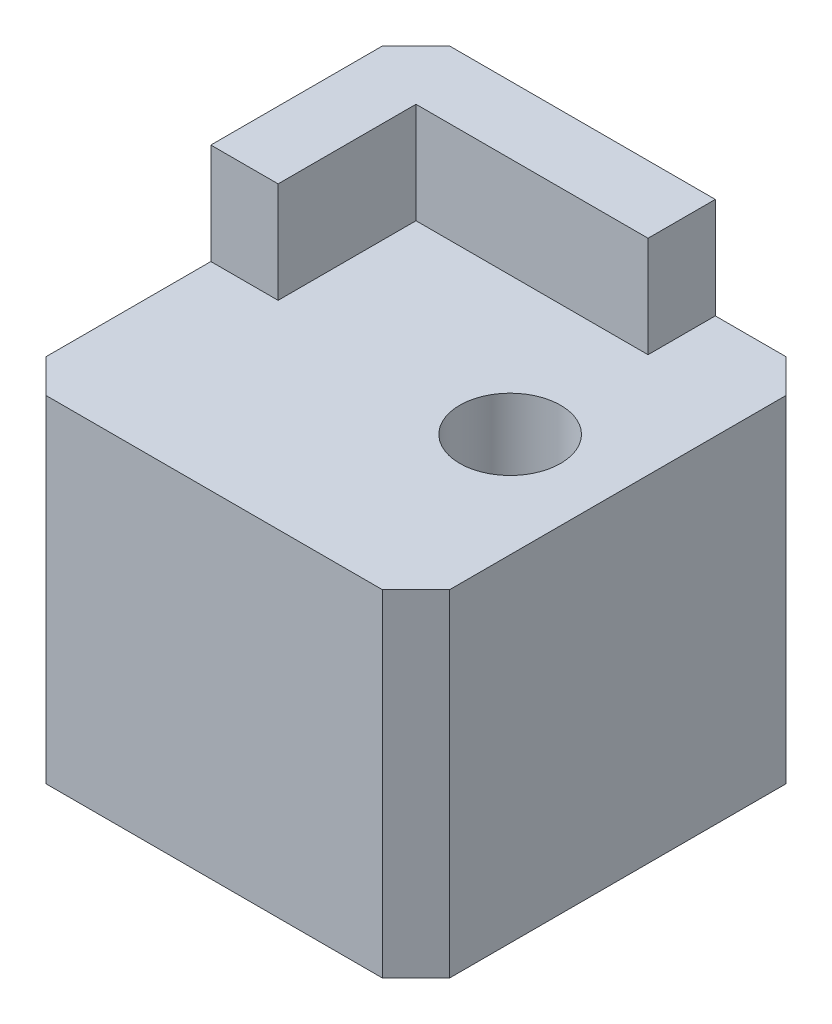
from build123d import *

# Parameters (mm, degrees)
SKETCH1_W           = 12
SKETCH1_H           = 12
BOSS_EXTRUDE1_DEPTH = 10
BOSS_EXTRUDE2_DEPTH = 3
CHAMFER1_SIZE       = 1
SKETCH1_4_R         = 1.5
CUT_EXTRUDE1_DEPTH  = 15.711220208


with BuildPart() as part:
    # Sketch1 → Boss-Extrude1 (new body)
    with BuildSketch(Plane(origin=(0, 0, 0), x_dir=(1, 0, 0), z_dir=(0, 1, 0))):
        with Locations((-2.9, 0.1)):
            Rectangle(SKETCH1_W, SKETCH1_H)
    extrude(amount=-BOSS_EXTRUDE1_DEPTH)

    # Sketch1<3> → Boss-Extrude2 (add)
    with BuildSketch(Plane(origin=(0, 0, 0), x_dir=(1, 0, 0), z_dir=(0, 1, 0))):
        Polygon((0, 6.1), (0, 4.1), (-6.9, 4.1), (-6.9, 0), (-8.9, 0), (-8.9, 6.1), align=None)
    extrude(amount=BOSS_EXTRUDE2_DEPTH)

    # Chamfer1
    chamfer1_edges = [part.edges().sort_by_distance(p)[0] for p in [
        (-8.9, -3.5, -6.1),
        (3.1, -5, -6.1),
        (3.1, -5, 5.9),
        (-8.9, -5, 5.9),
    ]]
    chamfer(chamfer1_edges, length=CHAMFER1_SIZE)

    # Sketch1<4> → Cut-Extrude1 (cut, through all)
    with BuildSketch(Plane(origin=(0, 0, 0), x_dir=(1, 0, 0), z_dir=(0, 1, 0))):
        with Locations(Location((0, 0, 0), (0, 0, 270))):
            Circle(SKETCH1_4_R)
    extrude(amount=-CUT_EXTRUDE1_DEPTH, mode=Mode.SUBTRACT)


solid = part.part
